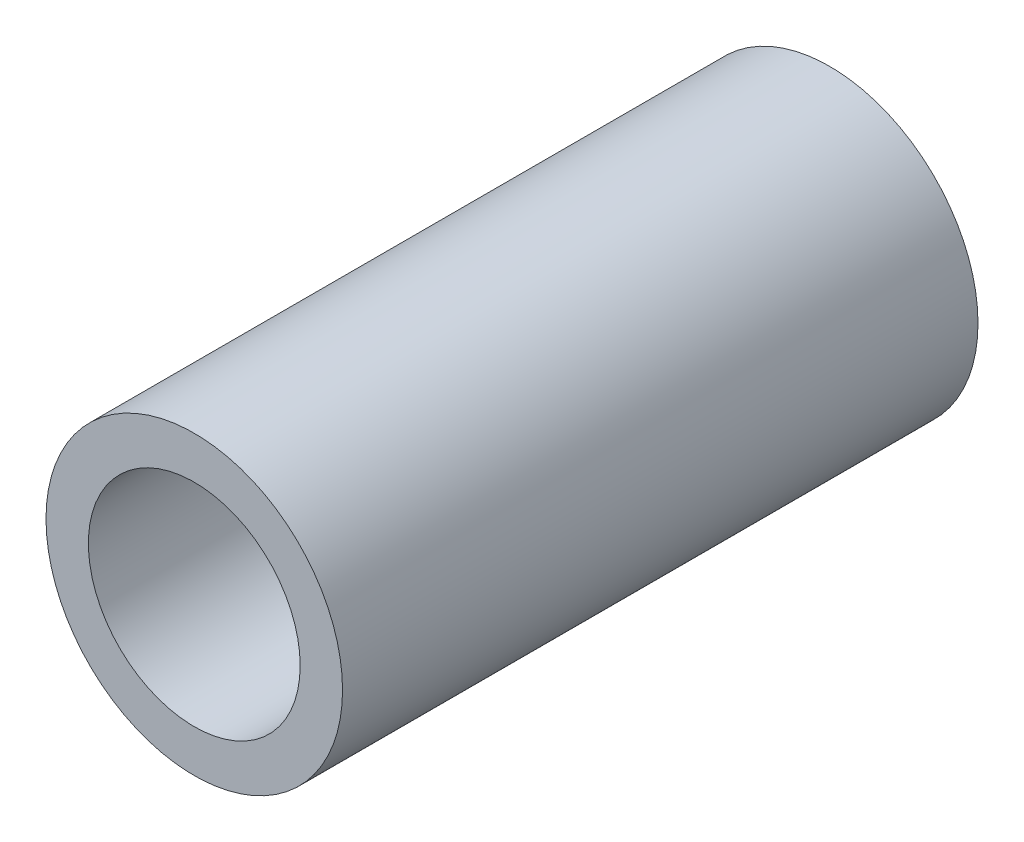
from build123d import *

# Parameters (mm, degrees)
SKETCH_1_R      = 7
SKETCH_1_R_2    = 5
EXTRUDE_1_DEPTH = 30


with BuildPart() as part:
    # Эскиз1 → Вытянуть-Тонкостенный1 (new body)
    with BuildSketch(Plane.XY):
        Circle(SKETCH_1_R)
        Circle(SKETCH_1_R_2, mode=Mode.SUBTRACT)
    extrude(amount=EXTRUDE_1_DEPTH)


solid = part.part
